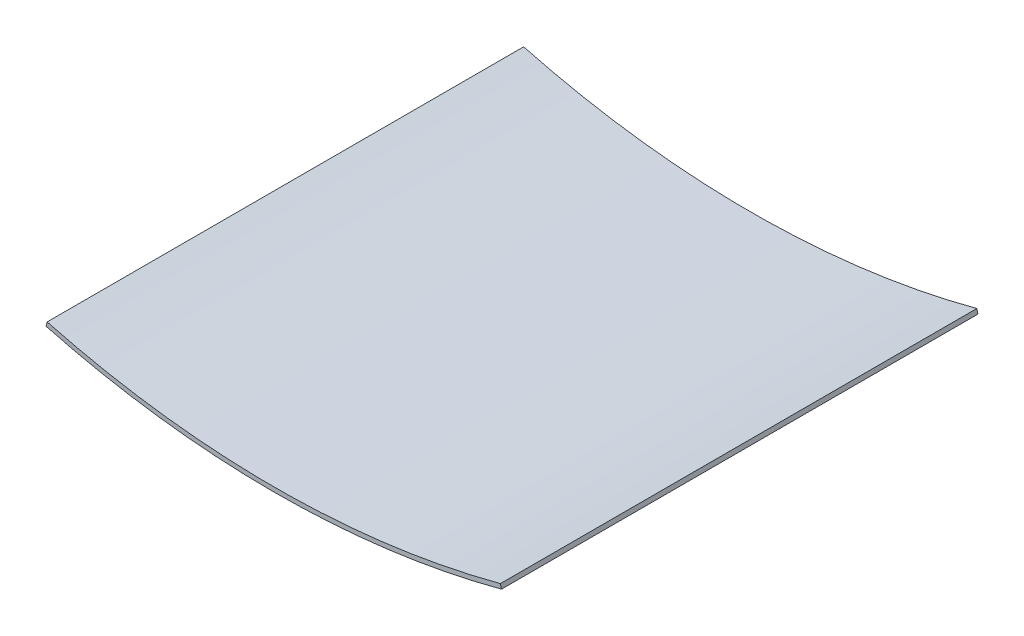
from build123d import *

# Parameters (mm, degrees)
EXTRUDE_THIN1_DEPTH = 410


with BuildPart() as part:
    # Sketch1 → Extrude-Thin1 (new body)
    with BuildSketch(Plane.XY):
        with BuildLine():
            ThreePointArc((-195, 25.4), (0, 0), (195, 25.4))
            Line((195, 25.4), (195.97599441, 21.717129528))
            ThreePointArc((195.97599441, 21.717129528), (0, -3.81), (-195.97599441, 21.717129528))
            Line((-195.97599441, 21.717129528), (-195, 25.4))
        make_face()
    extrude(amount=EXTRUDE_THIN1_DEPTH)


solid = part.part
